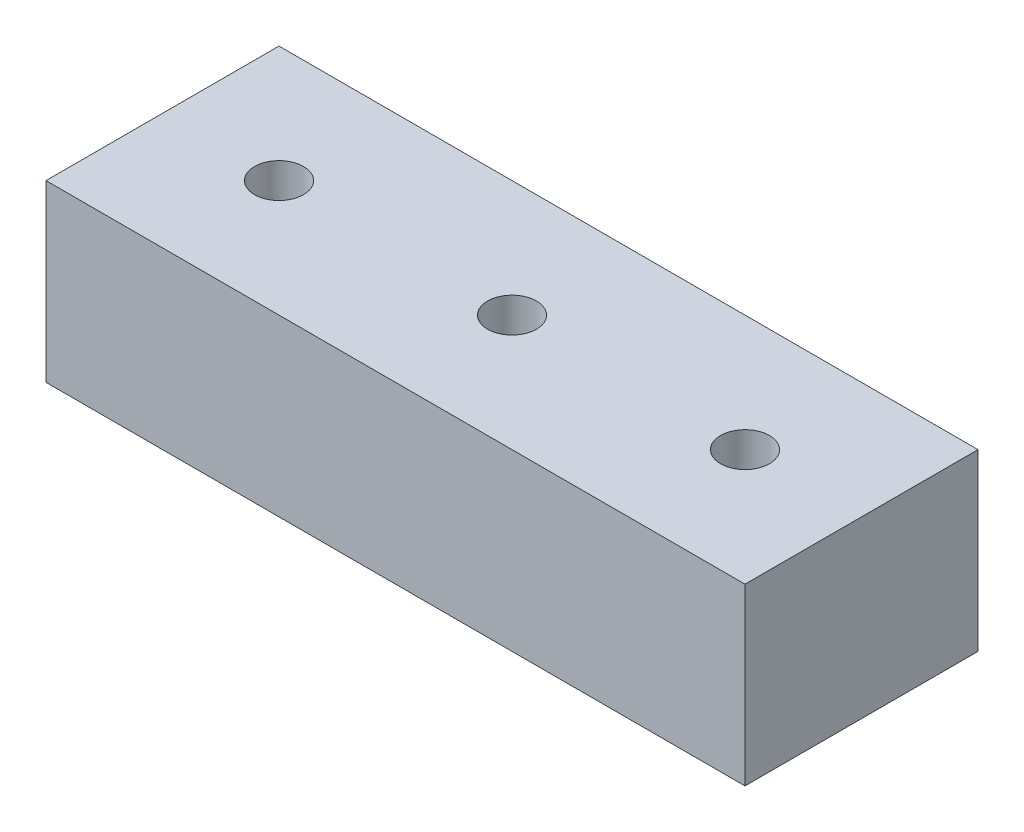
from build123d import *

# Parameters (mm, degrees)
SKETCH_1_W      = 60
SKETCH_1_H      = 20
SKETCH_1_R      = 2.1
EXTRUDE_1_DEPTH = 15


with BuildPart() as part:
    # 草图1 → 凸台-拉伸1 (new body)
    with BuildSketch(Plane(origin=(0, 0, 0), x_dir=(1, 0, 0), z_dir=(0, 1, 0))):
        with Locations((30, -10)):
            Rectangle(SKETCH_1_W, SKETCH_1_H)
        with Locations(Location((10, -10, 0), (0, 0, 270))):
            Circle(SKETCH_1_R, mode=Mode.SUBTRACT)
        with Locations(Location((30, -10, 0), (0, 0, 270))):
            Circle(SKETCH_1_R, mode=Mode.SUBTRACT)
        with Locations(Location((50, -10, 0), (0, 0, 270))):
            Circle(SKETCH_1_R, mode=Mode.SUBTRACT)
    extrude(amount=EXTRUDE_1_DEPTH)


solid = part.part
